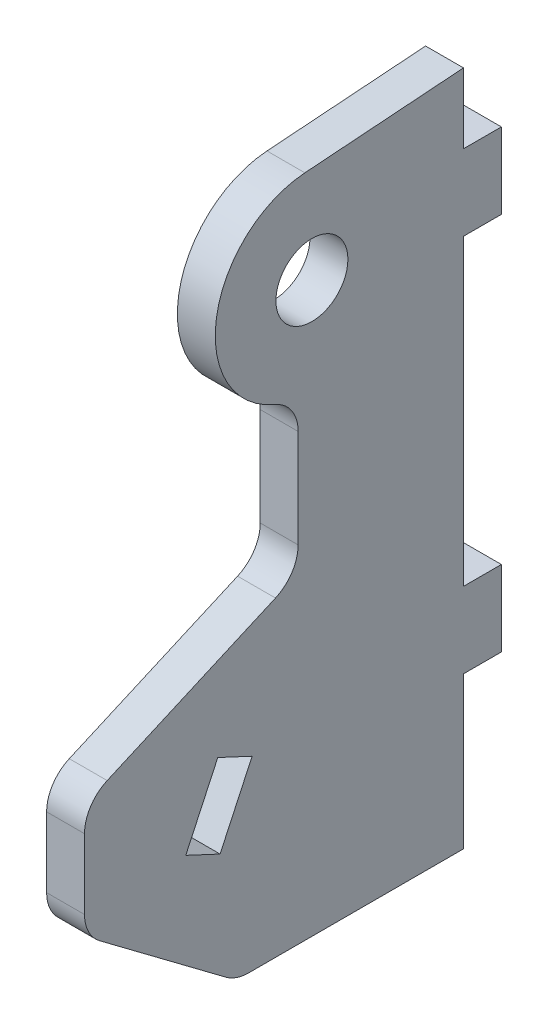
from build123d import *

# Parameters (mm, degrees)
SKETCH1_R           = 4.75
BOSS_EXTRUDE1_DEPTH = 2.5
FILLET1_R           = 5
CUT_EXTRUDE1_REACH  = 92.275
SKETCH3_W           = 5
SKETCH3_H           = 10
BOSS_EXTRUDE2_DEPTH = 5


with BuildPart() as part:
    # Sketch1 → Boss-Extrude1 (new, symmetric)
    with BuildSketch(Plane.YZ):
        with BuildLine():
            Line((-15.757717512, 0), (-5, 0))
            Line((-5, 0), (-5, -5))
            Line((-5, -5), (5, -5))
            Line((5, -5), (5, 0))
            Line((5, 0), (14.242282488, 0))
            Line((14.242282488, 0), (12.716235334, 20.927285791))
            ThreePointArc((12.716235334, 20.927285791), (0.446501859, 32.742179409), (-12.620138577, 21.815103933))
            Line((-12.620138577, 21.815103933), (-32.620138577, 21.815103933))
            Line((-32.620138577, 21.815103933), (-44.997717512, 50))
            Line((-44.997717512, 50), (-59.997717512, 50))
            Line((-59.997717512, 50), (-74.997717512, 30))
            Line((-74.997717512, 30), (-74.997717512, 0))
            Line((-74.997717512, 0), (-15.757717512, 0))
        make_face()
        with Locations(Location((0, 20, 0), (0, 0, 270))):
            Circle(SKETCH1_R, mode=Mode.SUBTRACT)
    extrude(amount=BOSS_EXTRUDE1_DEPTH, both=True)

    # Fillet1
    fillet1_edges = [part.edges().sort_by_distance(p)[0] for p in [
        (0, -74.997717512, 30),
        (0, -59.997717512, 50),
        (0, -44.997717512, 50),
        (0, -32.620138577, 21.815103933),
        (0, -12.620138577, 21.815103933),
    ]]
    fillet(fillet1_edges, radius=FILLET1_R)

    # Sketch2 → Cut-Extrude1 (cut, up to next)
    with BuildSketch(Plane.YZ.offset(2.5), mode=Mode.PRIVATE) as cut_extrude1_sk1:
        Polygon((-50.466178577, 27.886908691), (-59.529256447, 32.113091309), (-57.416165138, 36.644630244), (-48.353087268, 32.418447626), align=None)
    cut_extrude1_tool1 = extrude(cut_extrude1_sk1.sketch, amount=-CUT_EXTRUDE1_REACH, mode=Mode.PRIVATE) & part.part
    add(cut_extrude1_tool1.solids().sort_by_distance((2.5, -53.941172, 32.265769))[0], mode=Mode.SUBTRACT)

    # Sketch3 → Boss-Extrude2 (add)
    with BuildSketch(Plane(origin=(0, 0, 0), x_dir=(1, 0, 0), z_dir=(0, 0, -1))):
        with Locations((0, 50)):
            Rectangle(SKETCH3_W, SKETCH3_H)
    extrude(amount=BOSS_EXTRUDE2_DEPTH)


solid = part.part
